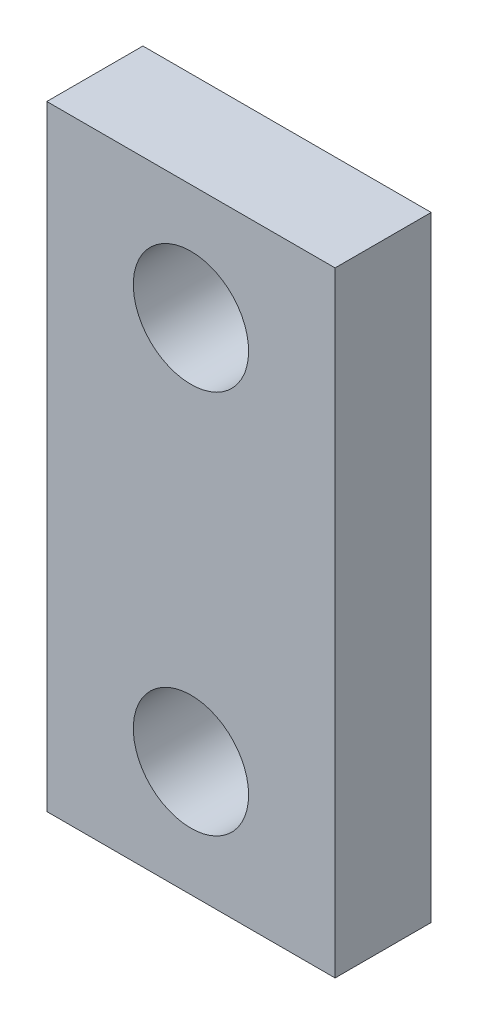
from build123d import *

# Parameters (mm, degrees)
SKETCH_1_W      = 15
SKETCH_1_H      = 32
SKETCH_1_R      = 3
EXTRUDE_1_DEPTH = 5


with BuildPart() as part:
    # 草图1 → 凸台-拉伸1 (new body)
    with BuildSketch(Plane.XY):
        Rectangle(SKETCH_1_W, SKETCH_1_H)
        with Locations((0, 10)):
            Circle(SKETCH_1_R, mode=Mode.SUBTRACT)
        with Locations((0, -10)):
            Circle(SKETCH_1_R, mode=Mode.SUBTRACT)
    extrude(amount=EXTRUDE_1_DEPTH)


solid = part.part
